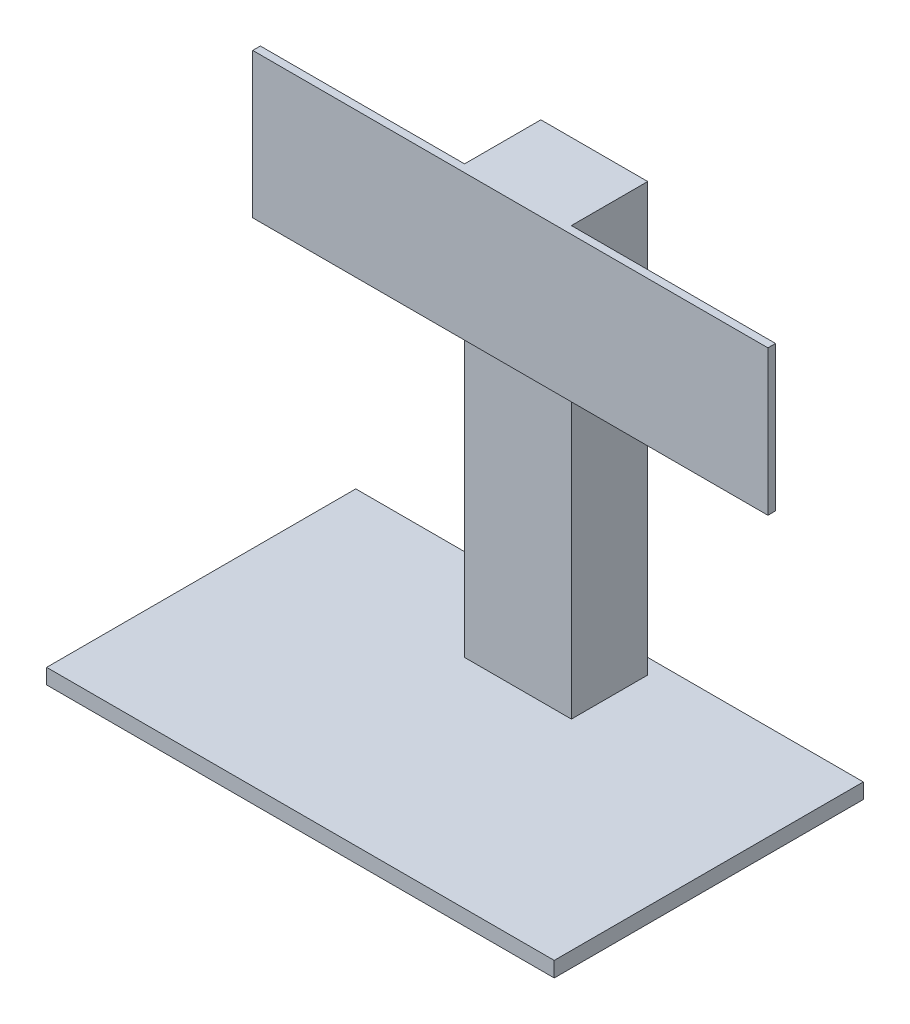
from build123d import *

# Parameters (mm, degrees)
SKETCH2_W           = 422.275
SKETCH2_H           = 257.175
BOSS_EXTRUDE1_DEPTH = 12.7
SKETCH3_W           = 88.9
SKETCH3_H           = 63.5
BOSS_EXTRUDE2_DEPTH = 355.6
SKETCH4_W           = 428.625
SKETCH4_H           = 120.65
BOSS_EXTRUDE3_DEPTH = 6.35


with BuildPart() as part:
    # Sketch2 → Boss-Extrude1 (new body)
    with BuildSketch(Plane(origin=(0, 0, 0), x_dir=(1, 0, 0), z_dir=(0, 1, 0))):
        Rectangle(SKETCH2_W, SKETCH2_H)
    extrude(amount=BOSS_EXTRUDE1_DEPTH)

    # Sketch3 → Boss-Extrude2 (add)
    with BuildSketch(Plane(origin=(0, 12.7, 0), x_dir=(1, 0, 0), z_dir=(0, 1, 0))):
        with Locations((0, 84.1375)):
            Rectangle(SKETCH3_W, SKETCH3_H)
    extrude(amount=BOSS_EXTRUDE2_DEPTH)

    # Sketch4 → Boss-Extrude3 (add)
    with BuildSketch(Plane.XY.offset(-52.3875)):
        with Locations((0, 307.975)):
            Rectangle(SKETCH4_W, SKETCH4_H)
    extrude(amount=BOSS_EXTRUDE3_DEPTH)


solid = part.part
